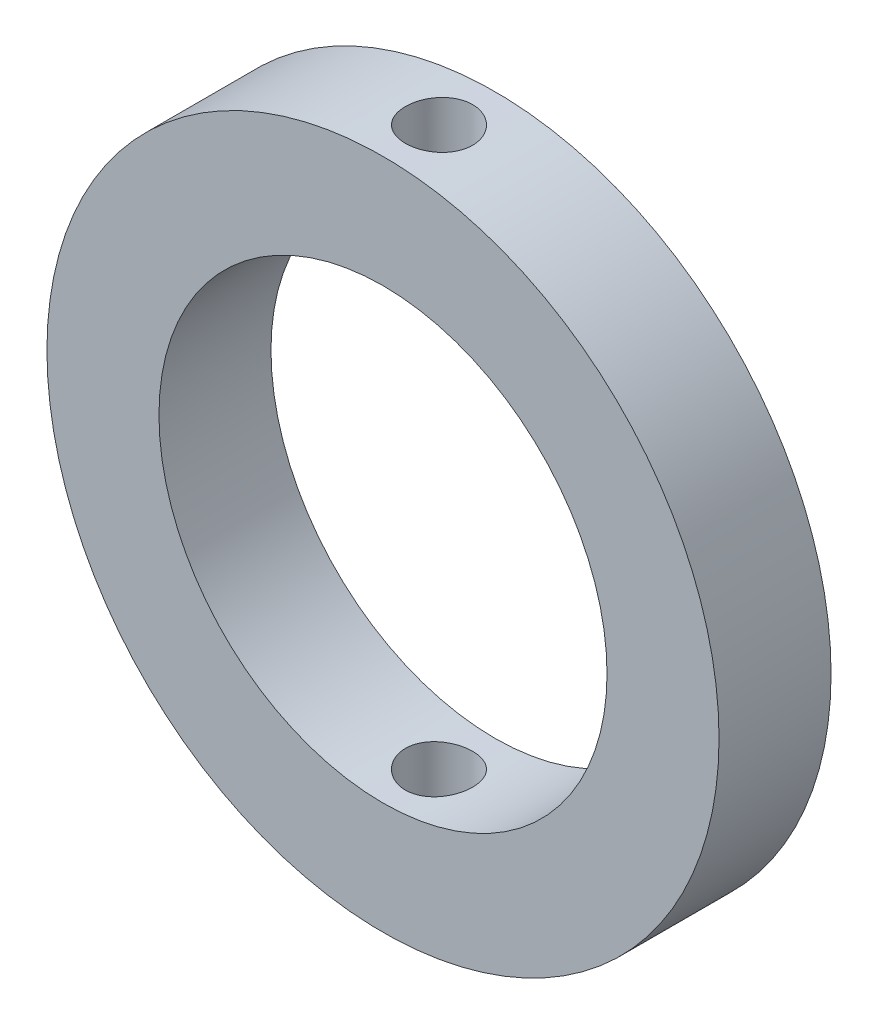
from build123d import *

# Parameters (mm, degrees)
SKETCH1_R               = 30
SKETCH1_R_2             = 20
BOSS_EXTRUDE1_DEPTH     = 10
CUT_EXTRUDE1_DEPTH      = 44.588989435
CUT_EXTRUDE1_DEPTH_BACK = 44.588989435
SKETCH2_R               = 3
SCALE1_SCALE            = 0.35


with BuildPart() as part:
    # Sketch1 → Boss-Extrude1 (new body)
    with BuildSketch(Plane.XY):
        Circle(SKETCH1_R)
        Circle(SKETCH1_R_2, mode=Mode.SUBTRACT)
    extrude(amount=BOSS_EXTRUDE1_DEPTH)

    # Sketch2 → Cut-Extrude1 (cut, two sides: drawn at the far end of the back side and taken through both)
    with BuildSketch(Plane(origin=(0, 0, 0), x_dir=(1, 0, 0), z_dir=(0, 1, 0)).offset(-CUT_EXTRUDE1_DEPTH_BACK)):
        with Locations(Location((0, -5, 0), (0, 0, 270))):
            Circle(SKETCH2_R)
    extrude(amount=CUT_EXTRUDE1_DEPTH + CUT_EXTRUDE1_DEPTH_BACK, mode=Mode.SUBTRACT)


with BuildPart() as part_1:
    # Scale1: scaled about (-0.001116422, 0, 4.999941886)
    add(part.part.scale(SCALE1_SCALE).moved(Location((-0.000725674, 0, 3.249962226))))


solid = part_1.part
